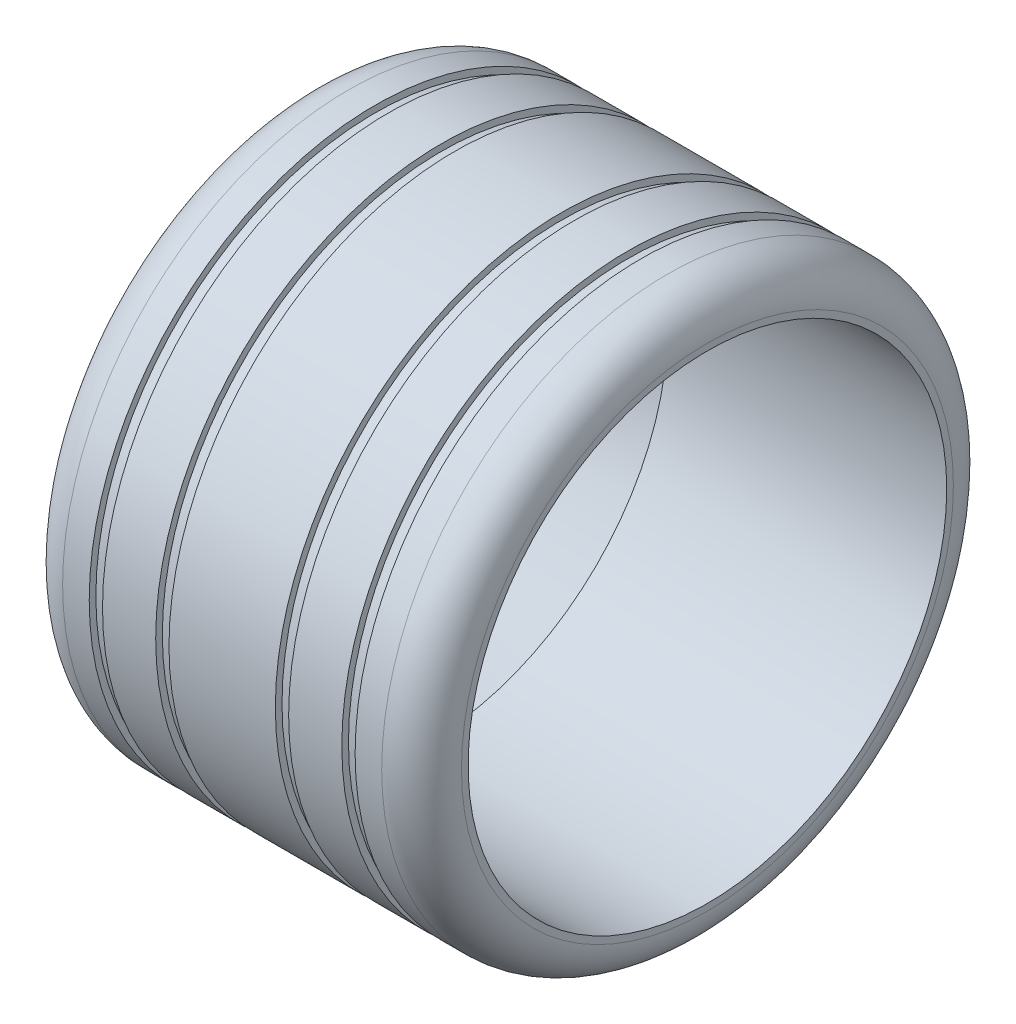
from build123d import *

# Parameters (mm, degrees)
SKETCH1_R           = 21.5
BOSS_EXTRUDE1_DEPTH = 30
SKETCH2_R           = 18
CUT_EXTRUDE1_DEPTH  = 25
SKETCH4_R           = 10.5
CUT_EXTRUDE2_DEPTH  = 43.714166268
FILLET1_R           = 3
SKETCH5_W           = 1
SKETCH5_H           = 0.5
CHAMFER1_SIZE       = 4
CHAMFER1_SIZE2      = 1.455880937


with BuildPart() as part:
    # Sketch1 → Boss-Extrude1 (new body)
    with BuildSketch(Plane(origin=(0, 0, 0), x_dir=(0, 0, -1), z_dir=(1, 0, 0))):
        Circle(SKETCH1_R)
    extrude(amount=BOSS_EXTRUDE1_DEPTH)

    # Sketch2 → Cut-Extrude1 (cut)
    with BuildSketch(Plane(origin=(30, 0, 0), x_dir=(0, 0, -1), z_dir=(1, 0, 0))):
        Circle(SKETCH2_R)
    extrude(amount=-CUT_EXTRUDE1_DEPTH, mode=Mode.SUBTRACT)

    # Sketch4 → Cut-Extrude2 (cut, through all)
    with BuildSketch(Plane.ZY):
        Circle(SKETCH4_R)
    extrude(amount=-CUT_EXTRUDE2_DEPTH, mode=Mode.SUBTRACT)

    # Fillet1
    fillet1_edges = [part.edges().sort_by_distance(p)[0] for p in [
        (0, 0, 21.5),
        (30, 0, 21.5),
    ]]
    fillet(fillet1_edges, radius=FILLET1_R)

    # Sketch5 → Cut-Revolve1 (revolve, cut)
    with BuildSketch(Plane.XY, mode=Mode.PRIVATE) as cut_revolve1_sk:
        with Locations((5.5, 21.25)):
            Rectangle(SKETCH5_W, SKETCH5_H)
        with Locations((24.5, 21.25)):
            Rectangle(SKETCH5_W, SKETCH5_H)
        with Locations((10.5, 21.25)):
            Rectangle(SKETCH5_W, SKETCH5_H)
        with Locations((19.5, 21.25)):
            Rectangle(SKETCH5_W, SKETCH5_H)
    revolve(cut_revolve1_sk.sketch.rotate(Axis((0, 0, 0), (1, 0, 0)), 90), axis=Axis((0, 0, 0), (1, 0, 0)), mode=Mode.SUBTRACT)

    # Chamfer1
    chamfer1_edges = [part.edges().sort_by_distance(p)[0] for p in [
        (5, 0, 18),
    ]]
    chamfer1_side = [part.faces().sort_by_distance(p)[0] for p in [
        (17.5, 0, 18),
    ]]
    chamfer(chamfer1_edges, length=CHAMFER1_SIZE, length2=CHAMFER1_SIZE2, reference=chamfer1_side[0])


solid = part.part
